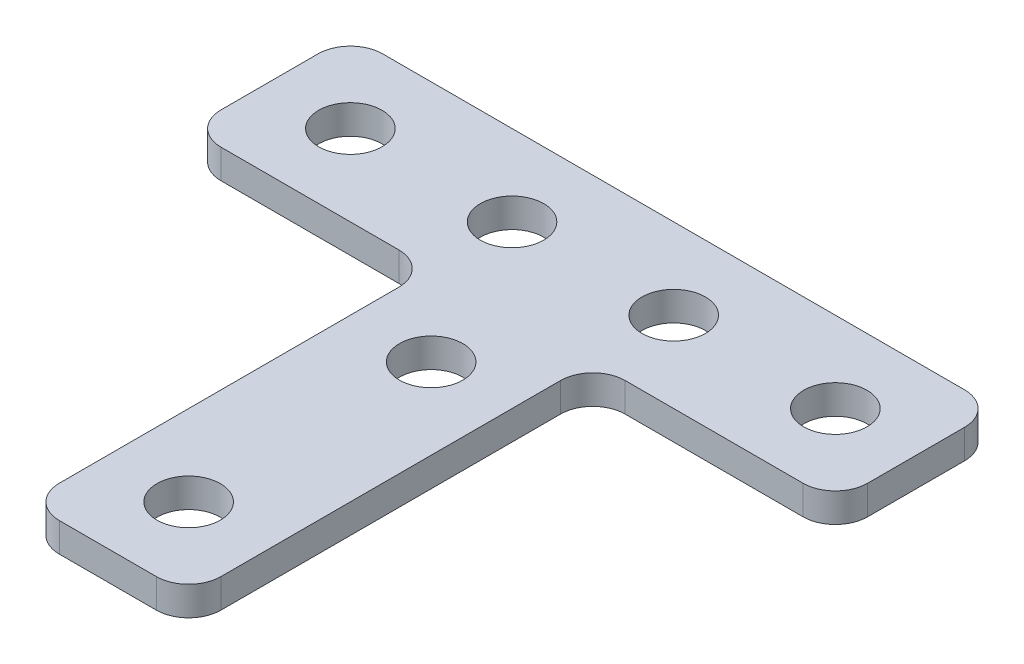
from build123d import *

# Parameters (mm, degrees)
SKETCH1_R           = 2.4892
SKETCH1_W           = 12.7
SKETCH1_H           = 31.75
BOSS_EXTRUDE1_DEPTH = 2.286
FILLET1_R           = 2.54


with BuildPart() as part:
    # Sketch1 → Boss-Extrude1 (new body)
    # profile 1 of 2: a face of its own
    with BuildSketch(Plane(origin=(0, 0, 0), x_dir=(1, 0, 0), z_dir=(0, 1, 0))):
        Polygon((-19.047100434, 31.75), (0, 31.75), (12.7, 31.75), (31.75, 31.75), (31.75, 44.45), (-19.047100434, 44.45), align=None)
        with Locations(Location((-12.697100434, 38.1, 0), (0, 0, 270))):
            Circle(SKETCH1_R, mode=Mode.SUBTRACT)
        with Locations(Location((0.002899566, 38.1, 0), (0, 0, 270))):
            Circle(SKETCH1_R, mode=Mode.SUBTRACT)
        with Locations(Location((12.702899566, 38.1, 0), (0, 0, 270))):
            Circle(SKETCH1_R, mode=Mode.SUBTRACT)
        with Locations(Location((25.4, 38.1, 0), (0, 0, 270))):
            Circle(SKETCH1_R, mode=Mode.SUBTRACT)
    # profile 2 of 2: a face of its own
    with BuildSketch(Plane(origin=(0, 0, 0), x_dir=(1, 0, 0), z_dir=(0, 1, 0))):
        with Locations((6.35, 15.875)):
            Rectangle(SKETCH1_W, SKETCH1_H)
        with Locations(Location((6.35, 25.4, 0), (0, 0, 270))):
            Circle(SKETCH1_R, mode=Mode.SUBTRACT)
        with Locations(Location((6.35, 6.35, 0), (0, 0, 270))):
            Circle(SKETCH1_R, mode=Mode.SUBTRACT)
    extrude(amount=BOSS_EXTRUDE1_DEPTH)

    # Fillet1
    fillet1_edges = [part.edges().sort_by_distance(p)[0] for p in [
        (-19.047100434, 1.143, -31.75),
        (-19.047100434, 1.143, -44.45),
        (31.75, 1.143, -44.45),
        (31.75, 1.143, -31.75),
        (12.7, 1.143, -31.75),
        (12.7, 1.143, 0),
        (0, 1.143, 0),
        (0, 1.143, -31.75),
    ]]
    fillet(fillet1_edges, radius=FILLET1_R)


solid = part.part
